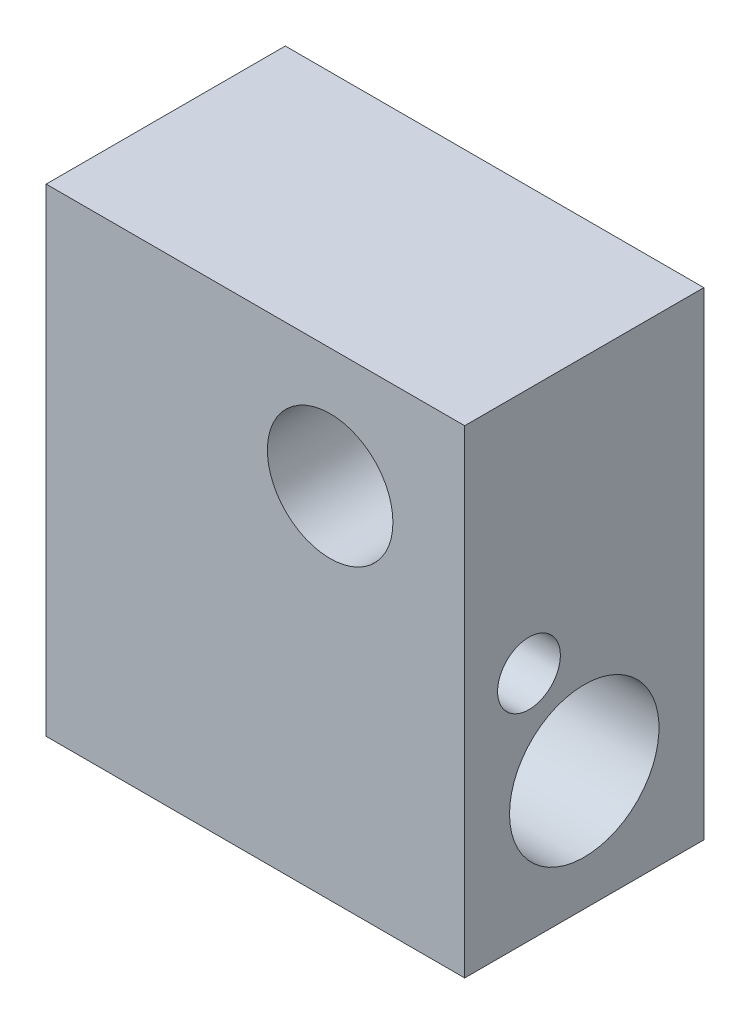
from build123d import *

# Parameters (mm, degrees)
SKETCH1_W                   = 14
SKETCH1_H                   = 16
BOSS_EXTRUDE1_DEPTH         = 8
TAP_DRILL_FOR_M5X0_8_TAP1_D = 4.2
F_5_0_5_DIAMETER_HOLE1_D    = 5
F_2_1_2_1_DIAMETER_HOLE1_D  = 2.1


with BuildPart() as part:
    # Sketch1 → Boss-Extrude1 (new body)
    with BuildSketch(Plane.XY):
        with Locations((7, 8)):
            Rectangle(SKETCH1_W, SKETCH1_H)
    extrude(amount=BOSS_EXTRUDE1_DEPTH)

    # Tap Drill for M5x0.8 Tap1 (through all)
    with Locations(Plane.XY.offset(8)):
        with Locations((9.5, 12)):
            Hole(TAP_DRILL_FOR_M5X0_8_TAP1_D / 2)

    # Ø5.0 (5) Diameter Hole1 (through all)
    with Locations(Plane.ZY):
        with Locations((4, 4)):
            Hole(F_5_0_5_DIAMETER_HOLE1_D / 2)

    # Ø2.1 (2.1) Diameter Hole1 (through all)
    with Locations(Plane.ZY):
        with Locations((5.85, 7.75)):
            Hole(F_2_1_2_1_DIAMETER_HOLE1_D / 2)


solid = part.part
